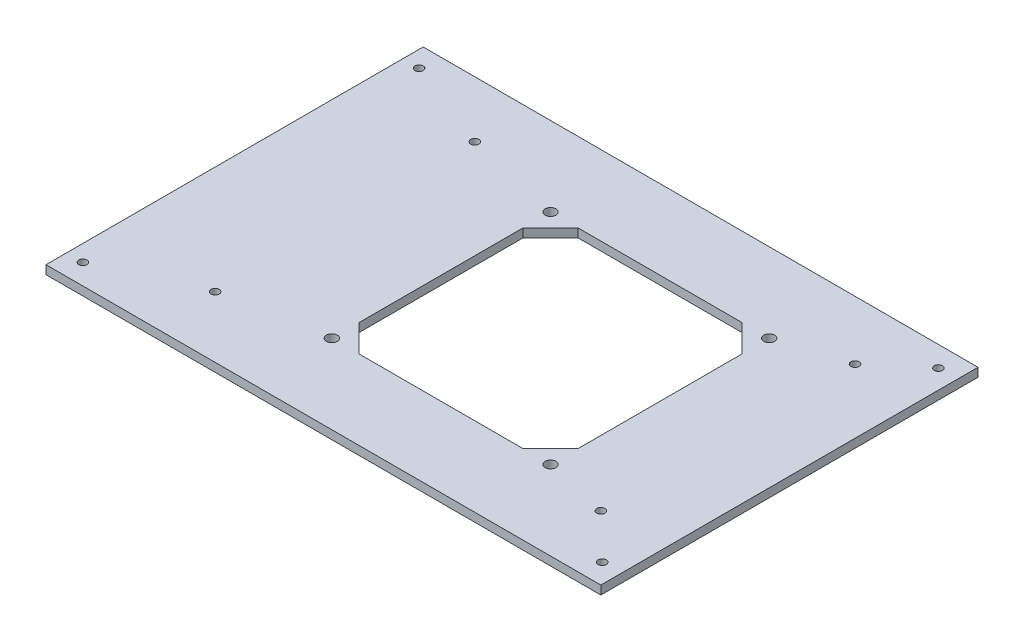
from build123d import *

# Parameters (mm, degrees)
SKETCH1_W             = 203
SKETCH1_H             = 138
BOSS_EXTRUDE1_DEPTH   = 3.175
F_3_0MM_DOWEL_HOLE1_D = 3
F_4_0MM_DOWEL_HOLE1_D = 4
CUT_EXTRUDE1_DEPTH    = 123.773493169


with BuildPart() as part:
    # Sketch1 → Boss-Extrude1 (new body)
    with BuildSketch(Plane(origin=(0, 0, 0), x_dir=(1, 0, 0), z_dir=(0, 1, 0))):
        Rectangle(SKETCH1_W, SKETCH1_H)
    extrude(amount=BOSS_EXTRUDE1_DEPTH)

    # Ø3.0mm Dowel Hole1 (through all)
    with Locations(Plane(origin=(0, 3.175, 0), x_dir=(1, 0, 0), z_dir=(0, 1, 0))):
        with Locations((-95.5, 61.5), (94.5, 61.5), (94.5, -61.5), (-95.5, -61.5), (-62, -46.6), (78, -45.5), (78, 47.5), (-62, 48.4)):
            Hole(F_3_0MM_DOWEL_HOLE1_D / 2)

    # Ø4.0mm Dowel Hole1 (through all)
    with Locations(Plane(origin=(0, 3.175, 0), x_dir=(1, 0, 0), z_dir=(0, 1, 0))):
        with Locations((-25.9, 40), (54.1, 40), (54.1, -40), (-25.9, -40)):
            Hole(F_4_0MM_DOWEL_HOLE1_D / 2)

    # Sketch7 → Cut-Extrude1 (cut, through all)
    with BuildSketch(Plane(origin=(0, 3.175, 0), x_dir=(1, 0, 0), z_dir=(0, 1, 0))):
        Polygon((-25.9, 30), (-15.9, 40), (44.1, 40), (54.1, 30), (54.1, -30), (44.1, -40), (-15.9, -40), (-25.9, -30), align=None)
    extrude(amount=-CUT_EXTRUDE1_DEPTH, mode=Mode.SUBTRACT)


solid = part.part
